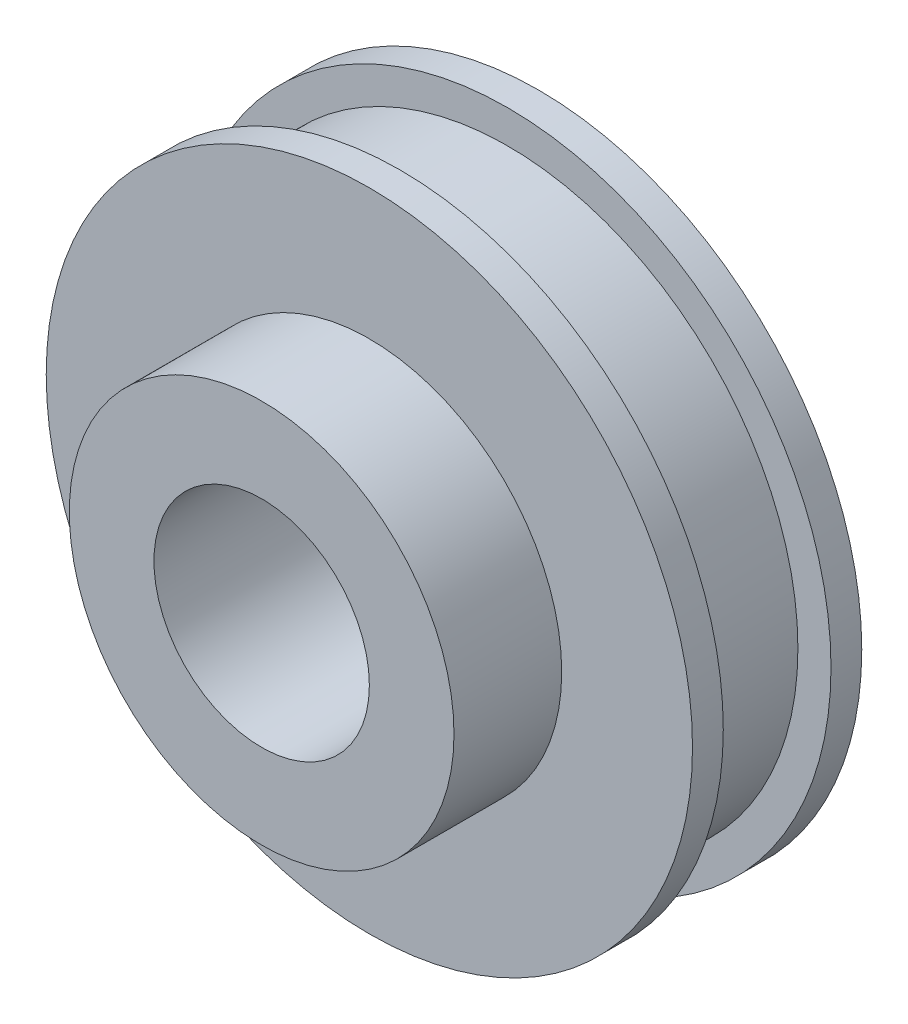
from build123d import *

# Parameters (mm, degrees)
SKETCH_1_R          = 21
EXTRUDE_1_DEPTH     = 2
SKETCH_2_R          = 18.85
EXTRUDE_2_DEPTH     = 7
SKETCH_3_R          = 21
EXTRUDE_3_DEPTH     = 2
SKETCH_4_R          = 12.5
EXTRUDE_4_DEPTH     = 7
SKETCH_5_R          = 7
CUT_EXTRUDE_1_DEPTH = 35.727510708


with BuildPart() as part:
    # 草图1 → 凸台-拉伸1 (new body)
    with BuildSketch(Plane.XY):
        Circle(SKETCH_1_R)
    extrude(amount=EXTRUDE_1_DEPTH)

    # 草图2 → 凸台-拉伸2 (add)
    with BuildSketch(Plane.XY.offset(2)):
        Circle(SKETCH_2_R)
    extrude(amount=EXTRUDE_2_DEPTH)

    # 草图3 → 凸台-拉伸3 (add)
    with BuildSketch(Plane.XY.offset(9)):
        Circle(SKETCH_3_R)
    extrude(amount=EXTRUDE_3_DEPTH)

    # 草图4 → 凸台-拉伸4 (add)
    with BuildSketch(Plane.XY.offset(11)):
        Circle(SKETCH_4_R)
    extrude(amount=EXTRUDE_4_DEPTH)

    # 草图5 → 切除-拉伸1 (cut, through all)
    with BuildSketch(Plane.XY.offset(18)):
        Circle(SKETCH_5_R)
    extrude(amount=-CUT_EXTRUDE_1_DEPTH, mode=Mode.SUBTRACT)


solid = part.part
